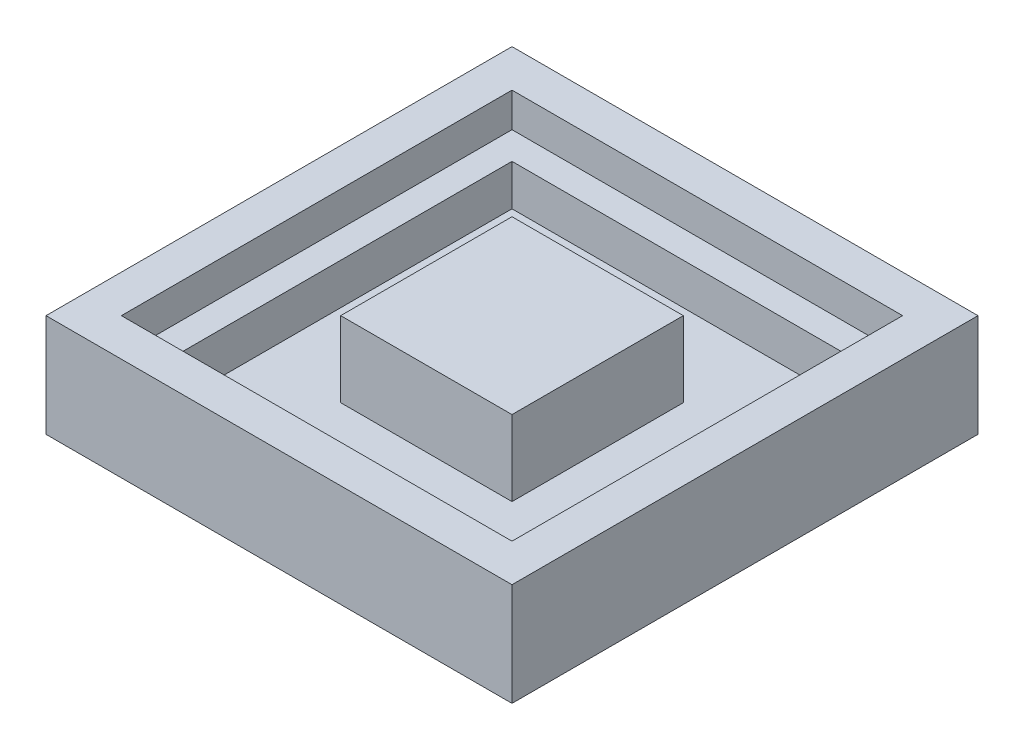
from build123d import *

# Parameters (mm, degrees)
SKETCH_1_W          = 34
SKETCH_1_H          = 34
EXTRUDE_1_DEPTH     = 8
SKETCH_2_W          = 24.5
SKETCH_2_H          = 24.5
CUT_EXTRUDE_1_DEPTH = 6
SKETCH_3_W          = 28.5
SKETCH_3_H          = 28.5
CUT_EXTRUDE_2_DEPTH = 3
SKETCH_4_W          = 12.5
SKETCH_4_H          = 12.5
EXTRUDE_2_DEPTH     = 6
SKETCH_5_W          = 34
SKETCH_5_H          = 34
SKETCH_5_W_2        = 28.5
SKETCH_5_H_2        = 28.5
SKETCH_5_W_3        = 12.5
SKETCH_5_H_3        = 12.5
CUT_EXTRUDE_4_DEPTH = 0.5


with BuildPart() as part:
    # Эскиз1 → Бобышка-Вытянуть1 (new body)
    with BuildSketch(Plane(origin=(0, 0, 0), x_dir=(1, 0, 0), z_dir=(0, 1, 0))):
        with Locations((17, 17)):
            Rectangle(SKETCH_1_W, SKETCH_1_H)
    extrude(amount=EXTRUDE_1_DEPTH)

    # Эскиз2 → Вырез-Вытянуть1 (cut)
    with BuildSketch(Plane(origin=(0, 8, 0), x_dir=(1, 0, 0), z_dir=(0, 1, 0))):
        with Locations((17, 17)):
            Rectangle(SKETCH_2_W, SKETCH_2_H)
    extrude(amount=-CUT_EXTRUDE_1_DEPTH, mode=Mode.SUBTRACT)

    # Эскиз3 → Вырез-Вытянуть2 (cut)
    with BuildSketch(Plane(origin=(0, 8, 0), x_dir=(1, 0, 0), z_dir=(0, 1, 0))):
        with Locations((17, 17)):
            Rectangle(SKETCH_3_W, SKETCH_3_H)
    extrude(amount=-CUT_EXTRUDE_2_DEPTH, mode=Mode.SUBTRACT)

    # Эскиз4 → Бобышка-Вытянуть2 (add)
    with BuildSketch(Plane(origin=(0, 2, 0), x_dir=(1, 0, 0), z_dir=(0, 1, 0))):
        with Locations((17, 17)):
            Rectangle(SKETCH_4_W, SKETCH_4_H)
    extrude(amount=EXTRUDE_2_DEPTH)

    # Эскиз5 → Вырез-Вытянуть4 (cut)
    # profile 1 of 2: a face of its own
    with BuildSketch(Plane(origin=(0, 8, 0), x_dir=(1, 0, 0), z_dir=(0, 1, 0))):
        with Locations((17, 17)):
            Rectangle(SKETCH_5_W, SKETCH_5_H)
        with Locations((17, 17)):
            Rectangle(SKETCH_5_W_2, SKETCH_5_H_2, mode=Mode.SUBTRACT)
    # profile 2 of 2: a face of its own
    with BuildSketch(Plane(origin=(0, 8, 0), x_dir=(1, 0, 0), z_dir=(0, 1, 0))):
        with Locations((17, 17)):
            Rectangle(SKETCH_5_W_3, SKETCH_5_H_3)
    extrude(amount=-CUT_EXTRUDE_4_DEPTH, mode=Mode.SUBTRACT)


solid = part.part
